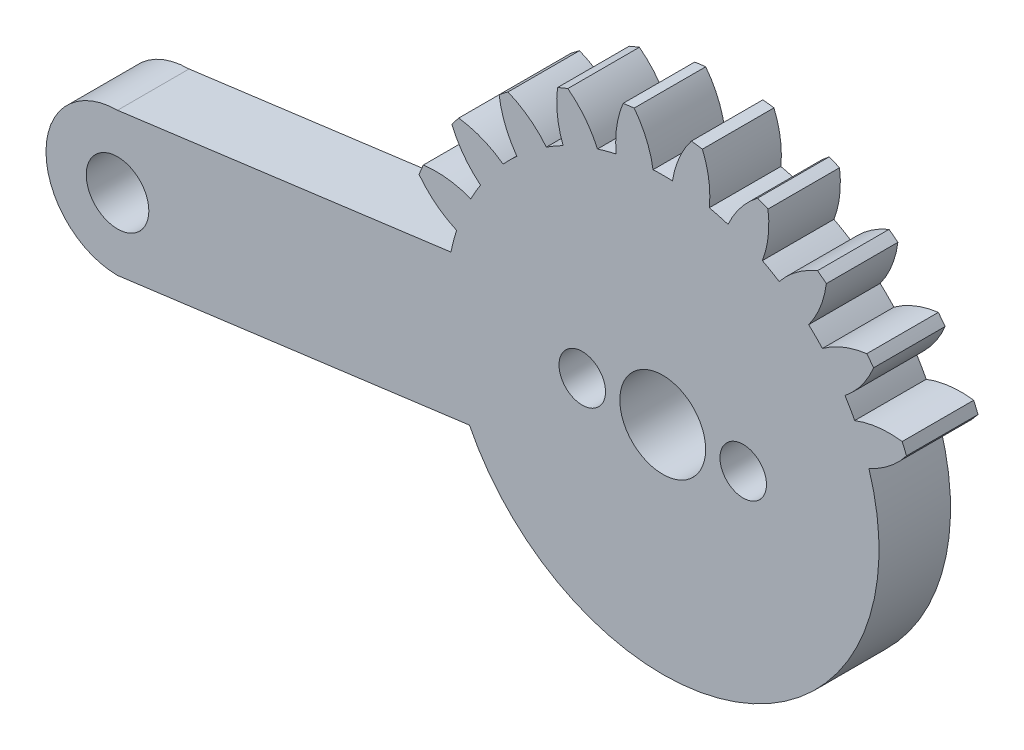
from build123d import *
from build123d.topology import SkipClean

# Parameters (mm, degrees)
SKETCH1_R           = 1.5
BOSS_EXTRUDE1_DEPTH = 4
SKETCH2_R           = 1.75
BOSS_EXTRUDE2_DEPTH = 4
CUT_EXTRUDE1_DEPTH  = 48.07674207
SKETCH4_R           = 2.4
SKETCH4_R_2         = 1.3
CUT_EXTRUDE2_DEPTH  = 48.07674207


with BuildPart() as part:
    # Sketch1 → Boss-Extrude1 (new body)
    with BuildSketch(Plane.XY):
        with BuildLine():
            Line((20.64, 4), (2.08, 4))
            ThreePointArc((2.08, 4), (2.859386397, 4.588201733), (3.5201075, 5.30713988))
            ThreePointArc((3.5201075, 5.30713988), (3.403753673, 5.596745198), (3.281246369, 5.883801663))
            ThreePointArc((3.281246369, 5.883801663), (1.933634043, 5.894040025), (0.625453025, 5.57027124))
            ThreePointArc((0.625453025, 5.57027124), (0.364644212, 6.046375), (0.082730667, 6.510293938))
            ThreePointArc((0.082730667, 6.510293938), (1.017213169, 7.48132754), (1.68215265, 8.65351323))
            ThreePointArc((1.68215265, 8.65351323), (1.494808112, 8.903135899), (1.302179463, 9.148703928))
            ThreePointArc((1.302179463, 9.148703928), (-0.002163969, 8.809805691), (-1.181972273, 8.158486898))
            ThreePointArc((-1.181972273, 8.158486898), (-1.557118962, 8.550865528), (-1.949497592, 8.926012217))
            ThreePointArc((-1.949497592, 8.926012217), (-1.298178799, 10.105820521), (-0.959280562, 11.410163953))
            ThreePointArc((-0.959280562, 11.410163953), (-1.204848591, 11.602792602), (-1.45447126, 11.79013714))
            ThreePointArc((-1.45447126, 11.79013714), (-2.62665695, 11.125197659), (-3.597690552, 10.190715157))
            ThreePointArc((-3.597690552, 10.190715157), (-4.06160949, 10.472628702), (-4.53771325, 10.733437515))
            ThreePointArc((-4.53771325, 10.733437515), (-4.213944465, 12.041618533), (-4.224182827, 13.389230859))
            ThreePointArc((-4.224182827, 13.389230859), (-4.511239292, 13.511738163), (-4.80084461, 13.62809199))
            ThreePointArc((-4.80084461, 13.62809199), (-5.760990039, 12.682425791), (-6.457074605, 11.528463019))
            ThreePointArc((-6.457074605, 11.528463019), (-6.978150482, 11.680699536), (-7.505533688, 11.809396783))
            ThreePointArc((-7.505533688, 11.809396783), (-7.531379219, 13.156800143), (-7.890056453, 14.455843809))
            ThreePointArc((-7.890056453, 14.455843809), (-8.199038929, 14.499881098), (-8.508890771, 14.537314892))
            ThreePointArc((-8.508890771, 14.537314892), (-9.191563616, 13.375367565), (-9.565262132, 12.080565177))
            ThreePointArc((-9.565262132, 12.080565177), (-10.10798449, 12.09275), (-10.650706848, 12.080565177))
            ThreePointArc((-10.650706848, 12.080565177), (-11.024405364, 13.375367565), (-11.707078209, 14.537314892))
            ThreePointArc((-11.707078209, 14.537314892), (-12.016930051, 14.499881098), (-12.325912527, 14.455843809))
            ThreePointArc((-12.325912527, 14.455843809), (-12.684589761, 13.156800143), (-12.710435292, 11.809396783))
            ThreePointArc((-12.710435292, 11.809396783), (-13.237818498, 11.680699536), (-13.758894375, 11.528463019))
            ThreePointArc((-13.758894375, 11.528463019), (-14.454978941, 12.682425791), (-15.41512437, 13.62809199))
            ThreePointArc((-15.41512437, 13.62809199), (-15.704729688, 13.511738163), (-15.991786153, 13.389230859))
            ThreePointArc((-15.991786153, 13.389230859), (-16.002024515, 12.041618533), (-15.67825573, 10.733437515))
            ThreePointArc((-15.67825573, 10.733437515), (-16.15435949, 10.472628702), (-16.618278428, 10.190715157))
            ThreePointArc((-16.618278428, 10.190715157), (-17.58931203, 11.125197659), (-18.76149772, 11.79013714))
            ThreePointArc((-18.76149772, 11.79013714), (-19.011120389, 11.602792602), (-19.256688418, 11.410163953))
            ThreePointArc((-19.256688418, 11.410163953), (-18.917790181, 10.105820521), (-18.266471388, 8.926012217))
            ThreePointArc((-18.266471388, 8.926012217), (-18.658850018, 8.550865528), (-19.033996707, 8.158486898))
            ThreePointArc((-19.033996707, 8.158486898), (-20.213805011, 8.809805691), (-21.518148443, 9.148703928))
            ThreePointArc((-21.518148443, 9.148703928), (-21.710777092, 8.903135899), (-21.89812163, 8.65351323))
            ThreePointArc((-21.89812163, 8.65351323), (-21.233182149, 7.48132754), (-20.298699647, 6.510293938))
            ThreePointArc((-20.298699647, 6.510293938), (-20.580613192, 6.046375), (-20.841422005, 5.57027124))
            ThreePointArc((-20.841422005, 5.57027124), (-22.149603023, 5.894040025), (-23.497215349, 5.883801663))
            ThreePointArc((-23.497215349, 5.883801663), (-23.619722653, 5.596745198), (-23.73607648, 5.30713988))
            ThreePointArc((-23.73607648, 5.30713988), (-22.790410282, 4.346994451), (-21.636447509, 3.650909885))
            ThreePointArc((-21.636447509, 3.650909885), (-21.788684026, 3.129834008), (-21.917381273, 2.602450802))
            ThreePointArc((-21.917381273, 2.602450802), (-23.264784633, 2.576605271), (-24.563828299, 2.217928037))
            ThreePointArc((-24.563828299, 2.217928037), (-24.607865588, 1.908945561), (-24.645299382, 1.599093719))
            ThreePointArc((-24.645299382, 1.599093719), (-23.483352055, 0.916420874), (-22.188549667, 0.542722358))
            ThreePointArc((-22.188549667, 0.542722358), (-22.20073449, 0), (-22.188549667, -0.542722358))
            ThreePointArc((-22.188549667, -0.542722358), (-23.483352055, -0.916420874), (-24.645299382, -1.599093719))
            ThreePointArc((-24.645299382, -1.599093719), (-24.607865588, -1.908945561), (-24.563828299, -2.217928037))
            ThreePointArc((-24.563828299, -2.217928037), (-23.264784633, -2.576605271), (-21.917381273, -2.602450802))
            ThreePointArc((-21.917381273, -2.602450802), (-21.788684026, -3.129834008), (-21.636447509, -3.650909885))
            ThreePointArc((-21.636447509, -3.650909885), (-22.790410282, -4.346994451), (-23.73607648, -5.30713988))
            ThreePointArc((-23.73607648, -5.30713988), (-23.619722653, -5.596745198), (-23.497215349, -5.883801663))
            ThreePointArc((-23.497215349, -5.883801663), (-22.149603023, -5.894040025), (-20.841422005, -5.57027124))
            ThreePointArc((-20.841422005, -5.57027124), (-20.580613192, -6.046375), (-20.298699647, -6.510293938))
            ThreePointArc((-20.298699647, -6.510293938), (-21.233182149, -7.48132754), (-21.89812163, -8.65351323))
            ThreePointArc((-21.89812163, -8.65351323), (-21.710777092, -8.903135899), (-21.518148443, -9.148703928))
            ThreePointArc((-21.518148443, -9.148703928), (-20.213805011, -8.809805691), (-19.033996707, -8.158486898))
            ThreePointArc((-19.033996707, -8.158486898), (-18.658850018, -8.550865528), (-18.266471388, -8.926012217))
            ThreePointArc((-18.266471388, -8.926012217), (-18.917790181, -10.105820521), (-19.256688418, -11.410163953))
            ThreePointArc((-19.256688418, -11.410163953), (-19.011120389, -11.602792602), (-18.76149772, -11.79013714))
            ThreePointArc((-18.76149772, -11.79013714), (-17.58931203, -11.125197659), (-16.618278428, -10.190715157))
            ThreePointArc((-16.618278428, -10.190715157), (-16.15435949, -10.472628702), (-15.67825573, -10.733437515))
            ThreePointArc((-15.67825573, -10.733437515), (-16.002024515, -12.041618533), (-15.991786153, -13.389230859))
            ThreePointArc((-15.991786153, -13.389230859), (-15.704729688, -13.511738163), (-15.41512437, -13.62809199))
            ThreePointArc((-15.41512437, -13.62809199), (-14.454978941, -12.682425791), (-13.758894375, -11.528463019))
            ThreePointArc((-13.758894375, -11.528463019), (-13.237818498, -11.680699536), (-12.710435292, -11.809396783))
            ThreePointArc((-12.710435292, -11.809396783), (-12.684589761, -13.156800143), (-12.325912527, -14.455843809))
            ThreePointArc((-12.325912527, -14.455843809), (-12.016930051, -14.499881098), (-11.707078209, -14.537314892))
            ThreePointArc((-11.707078209, -14.537314892), (-11.024405364, -13.375367565), (-10.650706848, -12.080565177))
            ThreePointArc((-10.650706848, -12.080565177), (-10.10798449, -12.09275), (-9.565262132, -12.080565177))
            ThreePointArc((-9.565262132, -12.080565177), (-9.191563616, -13.375367565), (-8.508890771, -14.537314892))
            ThreePointArc((-8.508890771, -14.537314892), (-8.199038929, -14.499881098), (-7.890056453, -14.455843809))
            ThreePointArc((-7.890056453, -14.455843809), (-7.531379219, -13.156800143), (-7.505533688, -11.809396783))
            ThreePointArc((-7.505533688, -11.809396783), (-6.978150482, -11.680699536), (-6.457074605, -11.528463019))
            ThreePointArc((-6.457074605, -11.528463019), (-5.760990039, -12.682425791), (-4.80084461, -13.62809199))
            ThreePointArc((-4.80084461, -13.62809199), (-4.511239292, -13.511738163), (-4.224182827, -13.389230859))
            ThreePointArc((-4.224182827, -13.389230859), (-4.213944465, -12.041618533), (-4.53771325, -10.733437515))
            ThreePointArc((-4.53771325, -10.733437515), (-4.06160949, -10.472628702), (-3.597690552, -10.190715157))
            ThreePointArc((-3.597690552, -10.190715157), (-2.62665695, -11.125197659), (-1.45447126, -11.79013714))
            ThreePointArc((-1.45447126, -11.79013714), (-1.204848591, -11.602792602), (-0.959280562, -11.410163953))
            ThreePointArc((-0.959280562, -11.410163953), (-1.298178799, -10.105820521), (-1.949497592, -8.926012217))
            ThreePointArc((-1.949497592, -8.926012217), (-1.557118962, -8.550865528), (-1.181972273, -8.158486898))
            ThreePointArc((-1.181972273, -8.158486898), (-0.002163969, -8.809805691), (1.302179463, -9.148703928))
            ThreePointArc((1.302179463, -9.148703928), (1.494808112, -8.903135899), (1.68215265, -8.65351323))
            ThreePointArc((1.68215265, -8.65351323), (1.017213169, -7.48132754), (0.082730667, -6.510293938))
            ThreePointArc((0.082730667, -6.510293938), (0.364644212, -6.046375), (0.625453025, -5.57027124))
            ThreePointArc((0.625453025, -5.57027124), (1.933634043, -5.894040025), (3.281246369, -5.883801663))
            ThreePointArc((3.281246369, -5.883801663), (3.403753673, -5.596745198), (3.5201075, -5.30713988))
            ThreePointArc((3.5201075, -5.30713988), (2.859386397, -4.588201733), (2.08, -4))
            Line((2.08, -4), (20.64, -4))
            ThreePointArc((20.64, -4), (24.64, 0), (20.64, 4))
        make_face()
        with Locations((-10.11, 0)):
            Circle(SKETCH1_R, mode=Mode.SUBTRACT)
        with Locations((20.64, 0)):
            Circle(SKETCH1_R, mode=Mode.SUBTRACT)
    extrude(amount=BOSS_EXTRUDE1_DEPTH)

    # Sketch2 → Boss-Extrude2 (add)
    with BuildSketch(Plane.XY.offset(4)):
        with BuildLine():
            ThreePointArc((-10.11, -4), (-14.075779445, -0.522104769), (-11.14527618, 3.863703305))
            Line((-11.14527618, 3.863703305), (-40.596929487, -0.013680411))
            ThreePointArc((-40.596929487, -0.013680411), (-44.596929487, -4.013680411), (-40.596929487, -8.013680411))
            Line((-40.596929487, -8.013680411), (-10.11, -4))
        make_face()
        with Locations((-40.596929487, -4.013680411)):
            Circle(SKETCH2_R, mode=Mode.SUBTRACT)
    extrude(amount=-BOSS_EXTRUDE2_DEPTH)

    # Sketch3 → Cut-Extrude1 (cut, through all)
    with SkipClean():  # the faces are left unmerged after this step: merging them gives an invalid solid
        with BuildSketch(Plane.XY.offset(4)):
            with BuildLine():
                ThreePointArc((-24.563828299, 2.217928037), (-24.573144452, 2.156333064), (-24.582198156, 2.094698967))
                Line((-24.582198156, 2.094698967), (-21.951807297, 2.440996493))
                ThreePointArc((-21.951807297, 2.440996493), (-21.934869799, 2.521782394), (-21.917381273, 2.602450802))
                ThreePointArc((-21.917381273, 2.602450802), (-23.264784633, 2.576605271), (-24.563828299, 2.217928037))
            make_face()
            with BuildLine():
                ThreePointArc((-20.841422005, -5.57027124), (-20.879319726, -5.496629859), (-20.916712206, -5.422730653))
                Line((-20.916712206, -5.422730653), (-23.547068935, -5.769023686))
                ThreePointArc((-23.547068935, -5.769023686), (-23.522264903, -5.826465995), (-23.497215349, -5.883801663))
                ThreePointArc((-23.497215349, -5.883801663), (-22.149603023, -5.894040025), (-20.841422005, -5.57027124))
            make_face()
            with BuildLine():
                ThreePointArc((1.420478529, 3.650909885), (1.94006926, -1.03875088), (0.625453025, -5.57027124))
                ThreePointArc((0.625453025, -5.57027124), (1.933634043, -5.894040025), (3.281246369, -5.883801663))
                ThreePointArc((3.281246369, -5.883801663), (3.403753673, -5.596745198), (3.5201075, -5.30713988))
                ThreePointArc((3.5201075, -5.30713988), (2.859386397, -4.588201733), (2.08, -4))
                Line((2.08, -4), (20.64, -4))
                ThreePointArc((20.64, -4), (24.64, 0), (20.64, 4))
                Line((20.64, 4), (2.08, 4))
                ThreePointArc((2.08, 4), (1.756276461, 3.814049117), (1.420478529, 3.650909885))
            make_face()
            with BuildLine():
                ThreePointArc((0.082730667, -6.510293938), (-0.514160884, -7.361599771), (-1.181972273, -8.158486898))
                ThreePointArc((-1.181972273, -8.158486898), (-0.002163969, -8.809805691), (1.302179463, -9.148703928))
                ThreePointArc((1.302179463, -9.148703928), (1.494808112, -8.903135899), (1.68215265, -8.65351323))
                ThreePointArc((1.68215265, -8.65351323), (1.017213169, -7.48132754), (0.082730667, -6.510293938))
            make_face()
            with BuildLine():
                ThreePointArc((-1.949497592, -8.926012217), (-2.746384719, -9.593823606), (-3.597690552, -10.190715157))
                ThreePointArc((-3.597690552, -10.190715157), (-2.62665695, -11.125197659), (-1.45447126, -11.79013714))
                ThreePointArc((-1.45447126, -11.79013714), (-1.204848591, -11.602792602), (-0.959280562, -11.410163953))
                ThreePointArc((-0.959280562, -11.410163953), (-1.298178799, -10.105820521), (-1.949497592, -8.926012217))
            make_face()
            with BuildLine():
                ThreePointArc((-4.53771325, -10.733437515), (-5.480289413, -11.172244217), (-6.457074605, -11.528463019))
                ThreePointArc((-6.457074605, -11.528463019), (-5.760990039, -12.682425791), (-4.80084461, -13.62809199))
                ThreePointArc((-4.80084461, -13.62809199), (-4.511239292, -13.511738163), (-4.224182827, -13.389230859))
                ThreePointArc((-4.224182827, -13.389230859), (-4.213944465, -12.041618533), (-4.53771325, -10.733437515))
            make_face()
            with BuildLine():
                ThreePointArc((-7.505533688, -11.809396783), (-8.529563879, -11.989294847), (-9.565262132, -12.080565177))
                ThreePointArc((-9.565262132, -12.080565177), (-9.191563616, -13.375367565), (-8.508890771, -14.537314892))
                ThreePointArc((-8.508890771, -14.537314892), (-8.199038929, -14.499881098), (-7.890056453, -14.455843809))
                ThreePointArc((-7.890056453, -14.455843809), (-7.531379219, -13.156800143), (-7.505533688, -11.809396783))
            make_face()
            with BuildLine():
                ThreePointArc((-10.650706848, -12.080565177), (-11.686405101, -11.989294847), (-12.710435292, -11.809396783))
                ThreePointArc((-12.710435292, -11.809396783), (-12.684589761, -13.156800143), (-12.325912527, -14.455843809))
                ThreePointArc((-12.325912527, -14.455843809), (-12.016930051, -14.499881098), (-11.707078209, -14.537314892))
                ThreePointArc((-11.707078209, -14.537314892), (-11.024405364, -13.375367565), (-10.650706848, -12.080565177))
            make_face()
            with BuildLine():
                ThreePointArc((-13.758894375, -11.528463019), (-14.735679567, -11.172244217), (-15.67825573, -10.733437515))
                ThreePointArc((-15.67825573, -10.733437515), (-16.002024515, -12.041618533), (-15.991786153, -13.389230859))
                ThreePointArc((-15.991786153, -13.389230859), (-15.704729688, -13.511738163), (-15.41512437, -13.62809199))
                ThreePointArc((-15.41512437, -13.62809199), (-14.454978941, -12.682425791), (-13.758894375, -11.528463019))
            make_face()
            with BuildLine():
                ThreePointArc((-16.618278428, -10.190715157), (-17.469584261, -9.593823606), (-18.266471388, -8.926012217))
                ThreePointArc((-18.266471388, -8.926012217), (-18.917790181, -10.105820521), (-19.256688418, -11.410163953))
                ThreePointArc((-19.256688418, -11.410163953), (-19.011120389, -11.602792602), (-18.76149772, -11.79013714))
                ThreePointArc((-18.76149772, -11.79013714), (-17.58931203, -11.125197659), (-16.618278428, -10.190715157))
            make_face()
            with BuildLine():
                ThreePointArc((-19.033996707, -8.158486898), (-19.701808096, -7.361599771), (-20.298699647, -6.510293938))
                ThreePointArc((-20.298699647, -6.510293938), (-21.233182149, -7.48132754), (-21.89812163, -8.65351323))
                ThreePointArc((-21.89812163, -8.65351323), (-21.710777092, -8.903135899), (-21.518148443, -9.148703928))
                ThreePointArc((-21.518148443, -9.148703928), (-20.213805011, -8.809805691), (-19.033996707, -8.158486898))
            make_face()
        extrude(amount=-CUT_EXTRUDE1_DEPTH, mode=Mode.SUBTRACT)

    # Sketch4 → Cut-Extrude2 (cut, through all)
    with SkipClean():  # the faces are left unmerged after this step: merging them gives an invalid solid
        with BuildSketch(Plane.XY.offset(4)):
            with Locations((-10.11, 0)):
                Circle(SKETCH4_R)
            with Locations((-5.61, 0)):
                Circle(SKETCH4_R_2)
            with Locations((-14.61, 0)):
                Circle(SKETCH4_R_2)
        extrude(amount=-CUT_EXTRUDE2_DEPTH, mode=Mode.SUBTRACT)


solid = part.part
